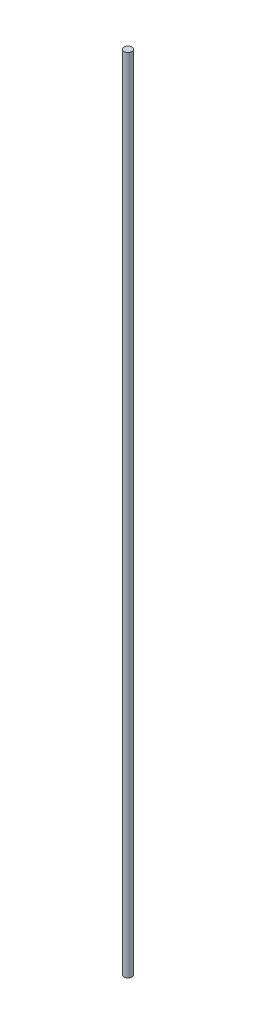
from build123d import *

# Parameters (mm, degrees)
BOSS_EXTRUDE1_DEPTH      = 415
BOSS_EXTRUDE1_DEPTH_BACK = 400
SKETCH1_R                = 4


with BuildPart() as part:
    # Sketch1 → Boss-Extrude1 (new, two sides: drawn at the far end of the back side and taken through both)
    with BuildSketch(Plane(origin=(0, 0, 0), x_dir=(1, 0, 0), z_dir=(0, 1, 0)).offset(-BOSS_EXTRUDE1_DEPTH_BACK)):
        with Locations(Location((0, 0, 0), (0, 0, 270))):
            Circle(SKETCH1_R)
    extrude(amount=BOSS_EXTRUDE1_DEPTH + BOSS_EXTRUDE1_DEPTH_BACK)


solid = part.part
